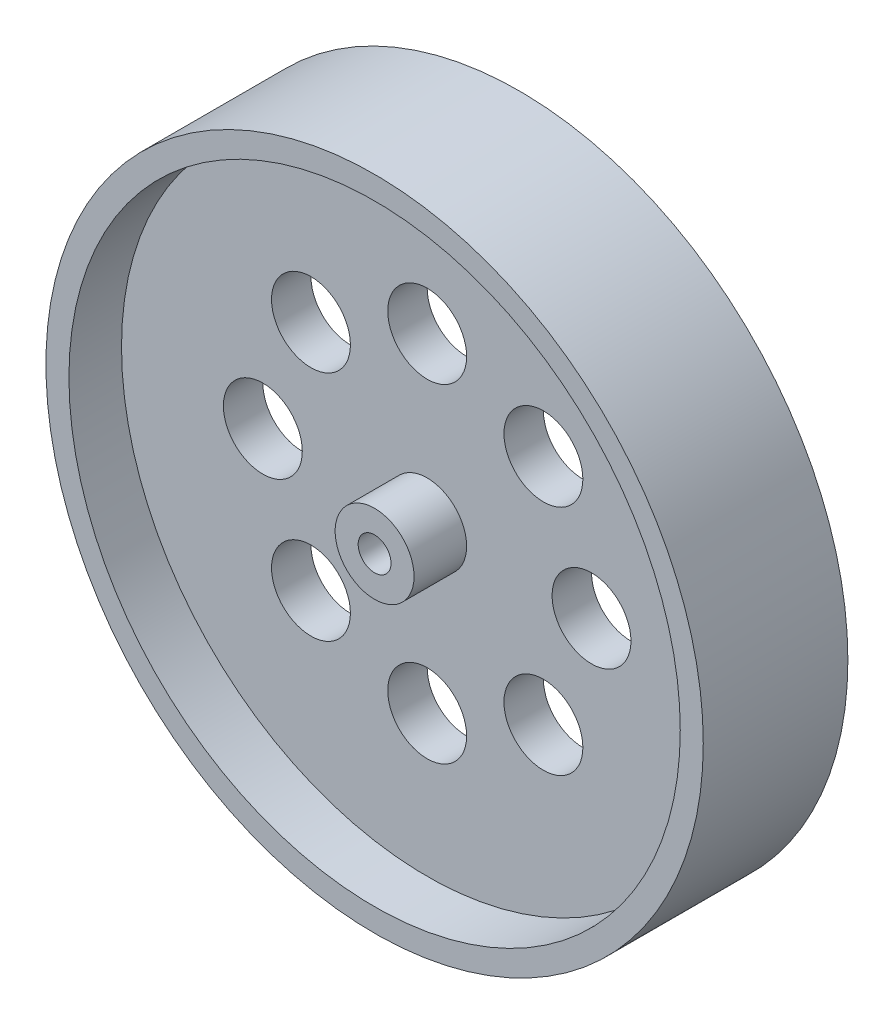
from build123d import *

# Parameters (mm, degrees)
ESQUISSE1_R              = 50
BOSS_EXTRU_1_DEPTH       = 22
ESQUISSE2_R              = 2.5
ENL_V_MAT_EXTRU_1_DEPTH  = 7
ENL_V_START              = -15
ENL_V_MAT_EXTRU_2_DEPTH  = 15
ESQUISSE5_R              = 46.5
ESQUISSE5_R_2            = 6
ENL_V_MAT_EXTRU_3_DEPTH  = 8
ENL_V_START_2            = -8
ESQUISSE7_R              = 46.5
ESQUISSE7_R_2            = 6
ENL_V_MAT_EXTRU_4_DEPTH  = 8
ESQUISSE8_R              = 6
ENL_V_MAT_EXTRU_5_DEPTH  = 8
ESQUISSE9_R              = 6
ENL_V_MAT_EXTRU_6_DEPTH  = 8
ESQUISSE10_R             = 6
ENL_V_MAT_EXTRU_7_DEPTH  = 8
ESQUISSE11_R             = 6
ENL_V_MAT_EXTRU_8_DEPTH  = 8
ESQUISSE12_R             = 6
ENL_V_MAT_EXTRU_10_DEPTH = 8
ESQUISSE13_R             = 6
ENL_V_MAT_EXTRU_11_DEPTH = 8
ESQUISSE14_R             = 6
ENL_V_MAT_EXTRU_12_DEPTH = 8
ESQUISSE15_R             = 6
ENL_V_MAT_EXTRU_13_DEPTH = 8


with BuildPart() as part:
    # Esquisse1 → Boss.-Extru.1 (new body)
    with BuildSketch(Plane.XY):
        Circle(ESQUISSE1_R)
    extrude(amount=BOSS_EXTRU_1_DEPTH)

    # Esquisse2 → Enlèv. mat.-Extru.1 (cut)
    with BuildSketch(Plane.XY.offset(22)):
        Circle(ESQUISSE2_R)
    extrude(amount=-ENL_V_MAT_EXTRU_1_DEPTH, mode=Mode.SUBTRACT)

    # Esquisse4 → Enlèv. mat.-Extru.2 (cut)
    with BuildSketch(Plane(origin=(0, 0, 0), x_dir=(-1, 0, 0), z_dir=(0, 0, -1)).offset(ENL_V_START)):
        with BuildLine():
            ThreePointArc((2.5, 0), (0.887540635, 2.337150321), (-1.869817297, 1.659452704))
            Line((-1.869817297, 1.659452704), (-2.496337165, -0.135280301))
            ThreePointArc((-2.496337165, -0.135280301), (0.06766494, -2.499084123), (2.5, 0))
        make_face()
    extrude(amount=ENL_V_MAT_EXTRU_2_DEPTH, mode=Mode.SUBTRACT)

    # Esquisse5 → Enlèv. mat.-Extru.3 (cut)
    with BuildSketch(Plane(origin=(0, 0, 0), x_dir=(-1, 0, 0), z_dir=(0, 0, -1))):
        Circle(ESQUISSE5_R)
        Circle(ESQUISSE5_R_2, mode=Mode.SUBTRACT)
    extrude(amount=-ENL_V_MAT_EXTRU_3_DEPTH, mode=Mode.SUBTRACT)

    # Esquisse7 → Enlèv. mat.-Extru.4 (cut)
    with BuildSketch(Plane.XY.offset(22).offset(ENL_V_START_2)):
        with Locations(Location((0, 0, 0), (0, 0, 180))):
            Circle(ESQUISSE7_R)
        with Locations(Location((0, 0, 0), (0, 0, 180))):
            Circle(ESQUISSE7_R_2, mode=Mode.SUBTRACT)
    extrude(amount=ENL_V_MAT_EXTRU_4_DEPTH, mode=Mode.SUBTRACT)

    # Esquisse8 → Enlèv. mat.-Extru.5 (cut)
    with BuildSketch(Plane(origin=(0, 0, 8), x_dir=(-1, 0, 0), z_dir=(0, 0, -1))):
        with Locations((-25, 0)):
            Circle(ESQUISSE8_R)
    extrude(amount=-ENL_V_MAT_EXTRU_5_DEPTH, mode=Mode.SUBTRACT)

    # Esquisse9 → Enlèv. mat.-Extru.6 (cut)
    with BuildSketch(Plane(origin=(0, 0, 8), x_dir=(-1, 0, 0), z_dir=(0, 0, -1))):
        with Locations((0, 25)):
            Circle(ESQUISSE9_R)
    extrude(amount=-ENL_V_MAT_EXTRU_6_DEPTH, mode=Mode.SUBTRACT)

    # Esquisse10 → Enlèv. mat.-Extru.7 (cut)
    with BuildSketch(Plane(origin=(0, 0, 8), x_dir=(-1, 0, 0), z_dir=(0, 0, -1))):
        with Locations((25, 0)):
            Circle(ESQUISSE10_R)
    extrude(amount=-ENL_V_MAT_EXTRU_7_DEPTH, mode=Mode.SUBTRACT)

    # Esquisse11 → Enlèv. mat.-Extru.8 (cut)
    with BuildSketch(Plane(origin=(0, 0, 8), x_dir=(-1, 0, 0), z_dir=(0, 0, -1))):
        with Locations((0, -25)):
            Circle(ESQUISSE11_R)
    extrude(amount=-ENL_V_MAT_EXTRU_8_DEPTH, mode=Mode.SUBTRACT)

    # Esquisse12 → Enlèv. mat.-Extru.10 (cut)
    with BuildSketch(Plane(origin=(0, 0, 8), x_dir=(-1, 0, 0), z_dir=(0, 0, -1))):
        with Locations((-17.68, 17.68)):
            Circle(ESQUISSE12_R)
    extrude(amount=-ENL_V_MAT_EXTRU_10_DEPTH, mode=Mode.SUBTRACT)

    # Esquisse13 → Enlèv. mat.-Extru.11 (cut)
    with BuildSketch(Plane(origin=(0, 0, 8), x_dir=(-1, 0, 0), z_dir=(0, 0, -1))):
        with Locations((17.68, 17.68)):
            Circle(ESQUISSE13_R)
    extrude(amount=-ENL_V_MAT_EXTRU_11_DEPTH, mode=Mode.SUBTRACT)

    # Esquisse14 → Enlèv. mat.-Extru.12 (cut)
    with BuildSketch(Plane(origin=(0, 0, 8), x_dir=(-1, 0, 0), z_dir=(0, 0, -1))):
        with Locations((-17.68, -17.68)):
            Circle(ESQUISSE14_R)
    extrude(amount=-ENL_V_MAT_EXTRU_12_DEPTH, mode=Mode.SUBTRACT)

    # Esquisse15 → Enlèv. mat.-Extru.13 (cut)
    with BuildSketch(Plane(origin=(0, 0, 8), x_dir=(-1, 0, 0), z_dir=(0, 0, -1))):
        with Locations((17.68, -17.68)):
            Circle(ESQUISSE15_R)
    extrude(amount=-ENL_V_MAT_EXTRU_13_DEPTH, mode=Mode.SUBTRACT)


solid = part.part
